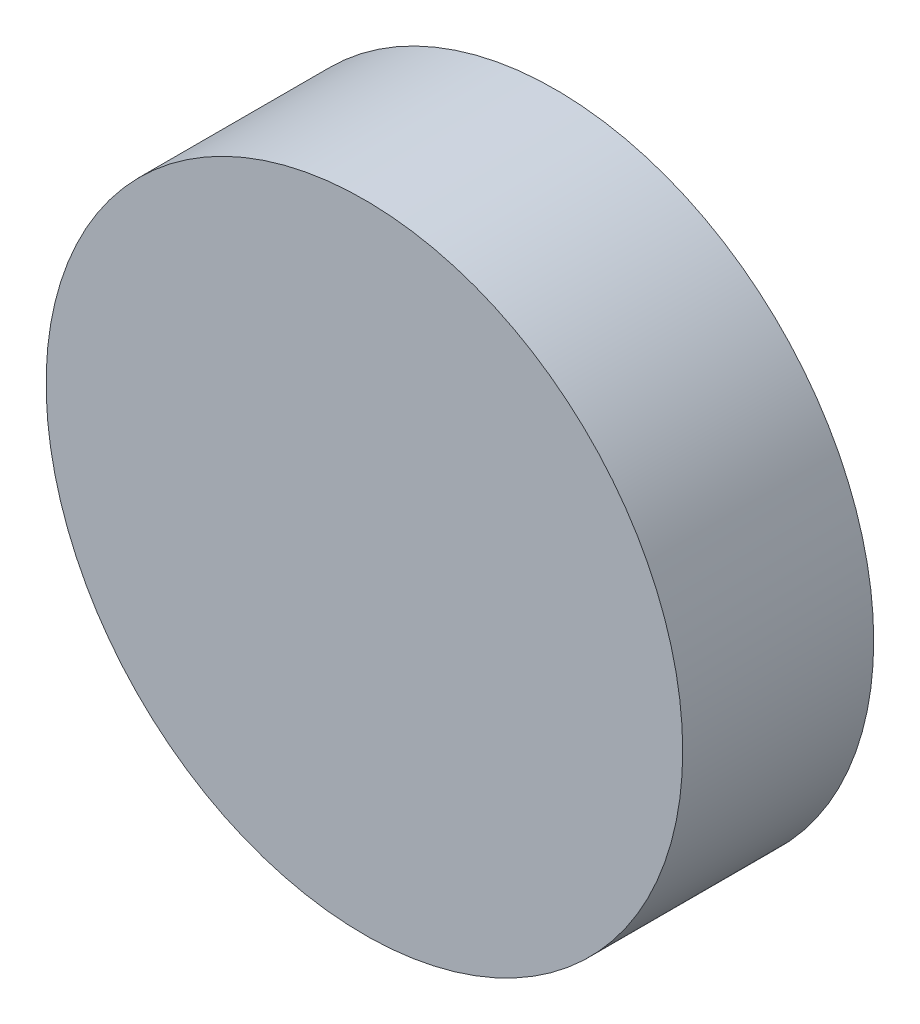
from build123d import *

# Parameters (mm, degrees)
SKETCH_1_R      = 5
EXTRUDE_1_DEPTH = 3


with BuildPart() as part:
    # 草图1 → 凸台-拉伸1 (new body)
    with BuildSketch(Plane.XY):
        Circle(SKETCH_1_R)
    extrude(amount=EXTRUDE_1_DEPTH)


solid = part.part
